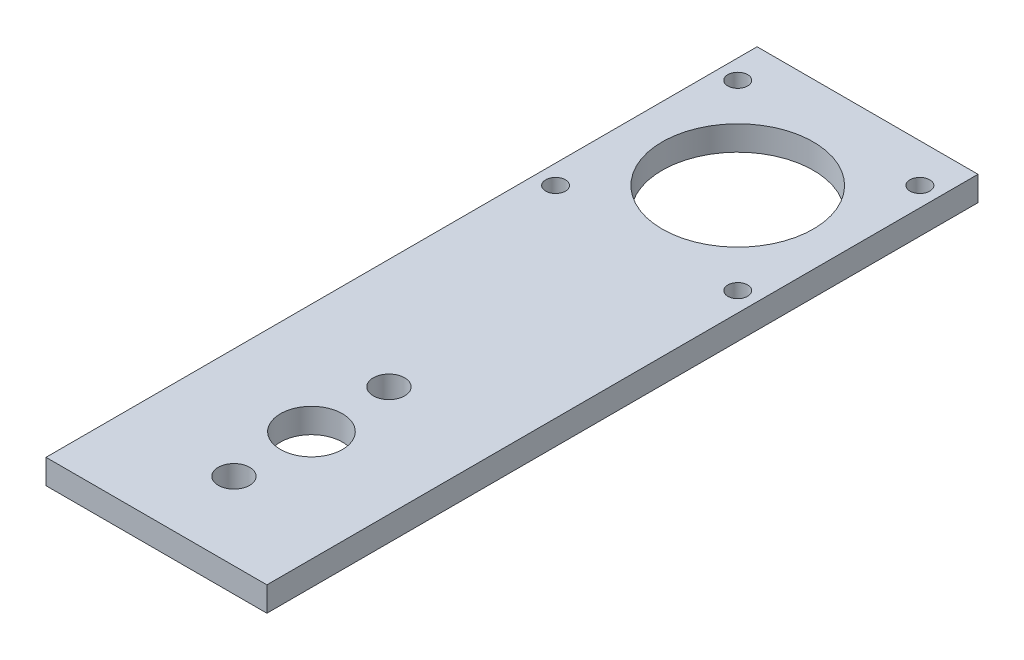
from build123d import *

# Parameters (mm, degrees)
SKETCH1_W           = 57
SKETCH1_H           = 183.5
SKETCH1_R           = 19.5
SKETCH1_R_2         = 2.55
SKETCH1_R_3         = 4.05
SKETCH1_R_4         = 8
BOSS_EXTRUDE1_DEPTH = 6.35


with BuildPart() as part:
    # Sketch1 → Boss-Extrude1 (new body)
    with BuildSketch(Plane(origin=(0, 0, 0), x_dir=(1, 0, 0), z_dir=(0, 1, 0))):
        with Locations((0, -58.25)):
            Rectangle(SKETCH1_W, SKETCH1_H)
        with Locations(Location((0, 0, 0), (0, 0, 270))):
            Circle(SKETCH1_R, mode=Mode.SUBTRACT)
        with Locations(Location((-23.5, 23.5, 0), (0, 0, 270))):
            Circle(SKETCH1_R_2, mode=Mode.SUBTRACT)
        with Locations(Location((23.5, 23.5, 0), (0, 0, 270))):
            Circle(SKETCH1_R_2, mode=Mode.SUBTRACT)
        with Locations(Location((23.5, -23.5, 0), (0, 0, 270))):
            Circle(SKETCH1_R_2, mode=Mode.SUBTRACT)
        with Locations(Location((-23.5, -23.5, 0), (0, 0, 270))):
            Circle(SKETCH1_R_2, mode=Mode.SUBTRACT)
        with Locations(Location((0, -90, 0), (0, 0, 270))):
            Circle(SKETCH1_R_3, mode=Mode.SUBTRACT)
        with Locations(Location((0, -130, 0), (0, 0, 270))):
            Circle(SKETCH1_R_3, mode=Mode.SUBTRACT)
        with Locations(Location((0, -110, 0), (0, 0, 270))):
            Circle(SKETCH1_R_4, mode=Mode.SUBTRACT)
    extrude(amount=BOSS_EXTRUDE1_DEPTH)


solid = part.part
